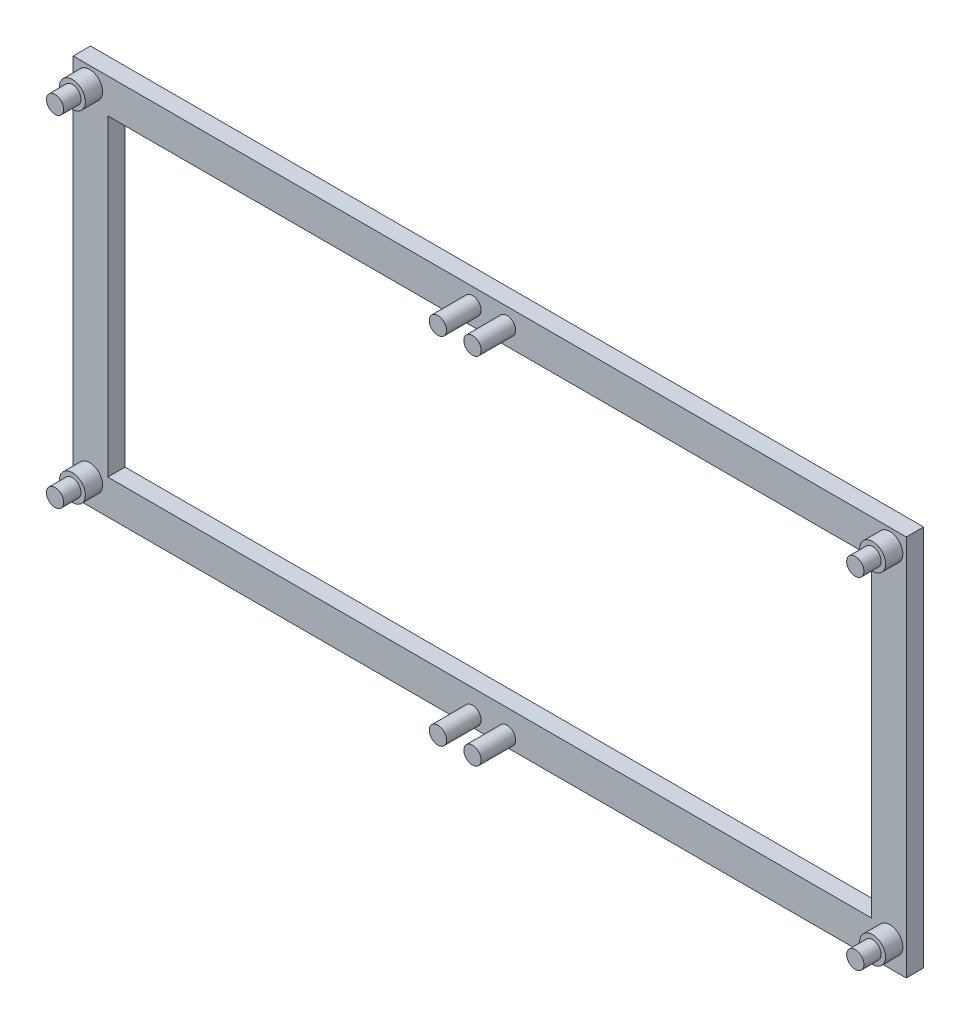
from build123d import *

# Parameters (mm, degrees)
SKETCH1_W           = 96.4
SKETCH1_H           = 44.2
SKETCH1_W_2         = 88.4
SKETCH1_H_2         = 36.2
BOSS_EXTRUDE1_DEPTH = 2
SKETCH2_R           = 1
BOSS_EXTRUDE2_DEPTH = 4
SKETCH3_R           = 1.5
BOSS_EXTRUDE3_DEPTH = 2


with BuildPart() as part:
    # Sketch1 → Boss-Extrude1 (new body)
    with BuildSketch(Plane.XY):
        Rectangle(SKETCH1_W, SKETCH1_H)
        Rectangle(SKETCH1_W_2, SKETCH1_H_2, mode=Mode.SUBTRACT)
    extrude(amount=BOSS_EXTRUDE1_DEPTH)

    # Sketch2 → Boss-Extrude2 (add)
    with BuildSketch(Plane.XY.offset(2)):
        with Locations((-46.3, 20.2)):
            Circle(SKETCH2_R)
        with Locations((-46.3, -19.2)):
            Circle(SKETCH2_R)
        with Locations((46.3, -19.2)):
            Circle(SKETCH2_R)
        with Locations((46.3, 20.2)):
            Circle(SKETCH2_R)
        with Locations((-2, 20.2)):
            Circle(SKETCH2_R)
        with Locations((-2, -20.862445561)):
            Circle(SKETCH2_R)
        with Locations((2, 20.2)):
            Circle(SKETCH2_R)
        with Locations((2, -20.862445561)):
            Circle(SKETCH2_R)
    extrude(amount=BOSS_EXTRUDE2_DEPTH)

    # Sketch3 → Boss-Extrude3 (add)
    with BuildSketch(Plane.XY.offset(2)):
        with Locations((-46.3, 20.2)):
            Circle(SKETCH3_R)
        with Locations((-46.3, -19.2)):
            Circle(SKETCH3_R)
        with Locations((46.3, -19.2)):
            Circle(SKETCH3_R)
        with Locations((46.3, 20.2)):
            Circle(SKETCH3_R)
    extrude(amount=BOSS_EXTRUDE3_DEPTH)


solid = part.part
